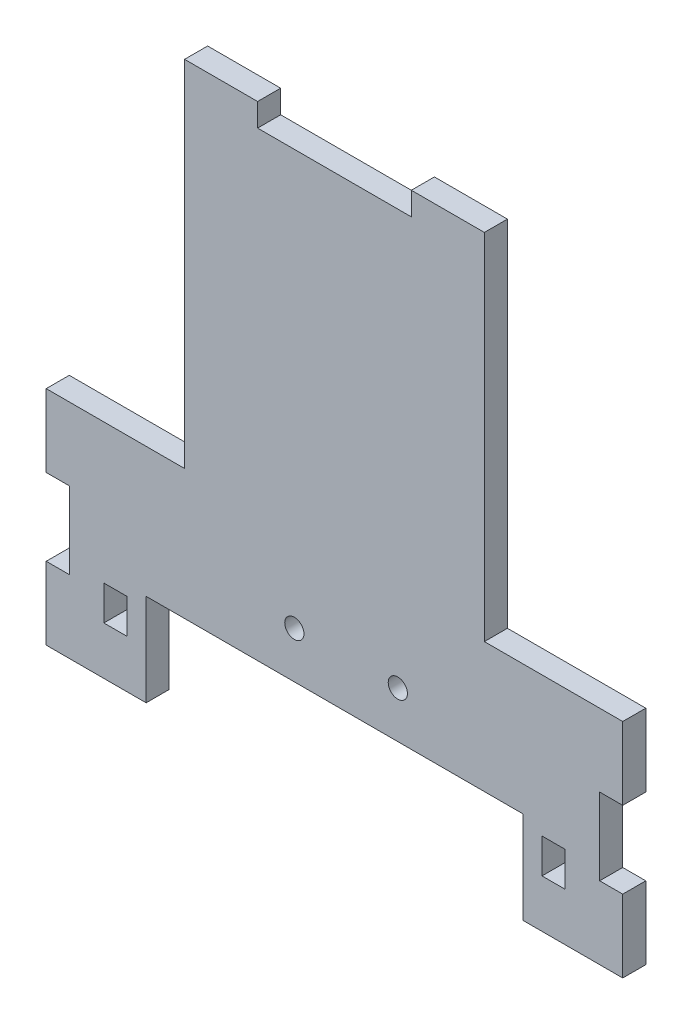
from build123d import *

# Parameters (mm, degrees)
SALIENTE_EXTRUIR1_DEPTH = 3
CROQUIS4_W              = 49
CROQUIS4_H              = 12
CORTAR_EXTRUIR2_DEPTH   = 10
CROQUIS5_R              = 1.25
CORTAR_EXTRUIR3_DEPTH   = 10
CROQUIS6_W              = 3
CROQUIS6_H              = 4.5
CORTAR_EXTRUIR4_DEPTH   = 10


with BuildPart() as part:
    # Croquis1 → Saliente-Extruir1 (new body)
    with BuildSketch(Plane.XY):
        Polygon((0, 28.9), (18, 28.9), (18, 75), (27.5, 75), (27.5, 72), (47.5, 72), (47.5, 75), (57, 75), (57, 28.9), (75, 28.9), (75, 19.45), (72, 19.45), (72, 9.45), (75, 9.45), (75, 0), (0, 0), (0, 9.45), (3, 9.45), (3, 19.45), (0, 19.45), align=None)
    extrude(amount=SALIENTE_EXTRUIR1_DEPTH)

    # Croquis4 → Cortar-Extruir2 (cut)
    with BuildSketch(Plane.XY.offset(3)):
        with Locations((37.5, 6)):
            Rectangle(CROQUIS4_W, CROQUIS4_H)
    extrude(amount=-CORTAR_EXTRUIR2_DEPTH, mode=Mode.SUBTRACT)

    # Croquis5 → Cortar-Extruir3 (cut)
    with BuildSketch(Plane(origin=(0, 0, 0), x_dir=(-1, 0, 0), z_dir=(0, 0, -1))):
        with Locations((-32.279739901, 18.033331943)):
            Circle(CROQUIS5_R)
        with Locations((-45.741739901, 18.033331943)):
            Circle(CROQUIS5_R)
    extrude(amount=-CORTAR_EXTRUIR3_DEPTH, mode=Mode.SUBTRACT)

    # Croquis6 → Cortar-Extruir4 (cut)
    with BuildSketch(Plane(origin=(0, 0, 0), x_dir=(-1, 0, 0), z_dir=(0, 0, -1))):
        with Locations((-9, 8.5)):
            Rectangle(CROQUIS6_W, CROQUIS6_H)
        with Locations((-66, 8.5)):
            Rectangle(CROQUIS6_W, CROQUIS6_H)
    extrude(amount=-CORTAR_EXTRUIR4_DEPTH, mode=Mode.SUBTRACT)


solid = part.part
